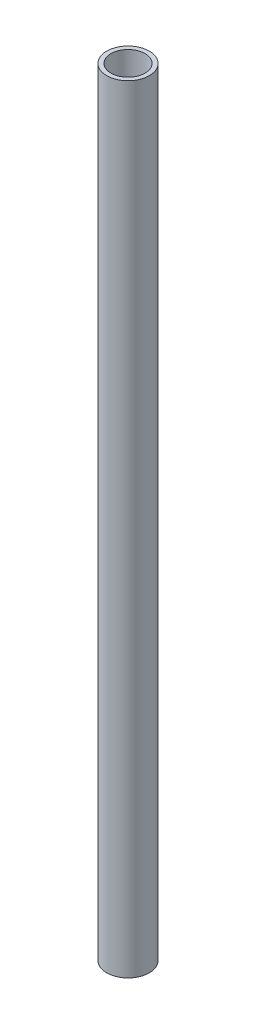
from build123d import *

# Parameters (mm, degrees)
SKETCH1_R           = 16.7005
SKETCH1_R_2         = 13.335
BOSS_EXTRUDE1_DEPTH = 609.6


with BuildPart() as part:
    # Sketch1 → Boss-Extrude1 (new body)
    with BuildSketch(Plane(origin=(0, 0, 0), x_dir=(1, 0, 0), z_dir=(0, 1, 0))):
        with Locations(Location((0, 0, 0), (0, 0, 90))):
            Circle(SKETCH1_R)
        with Locations(Location((0, 0, 0), (0, 0, 90))):
            Circle(SKETCH1_R_2, mode=Mode.SUBTRACT)
    extrude(amount=BOSS_EXTRUDE1_DEPTH)


solid = part.part
